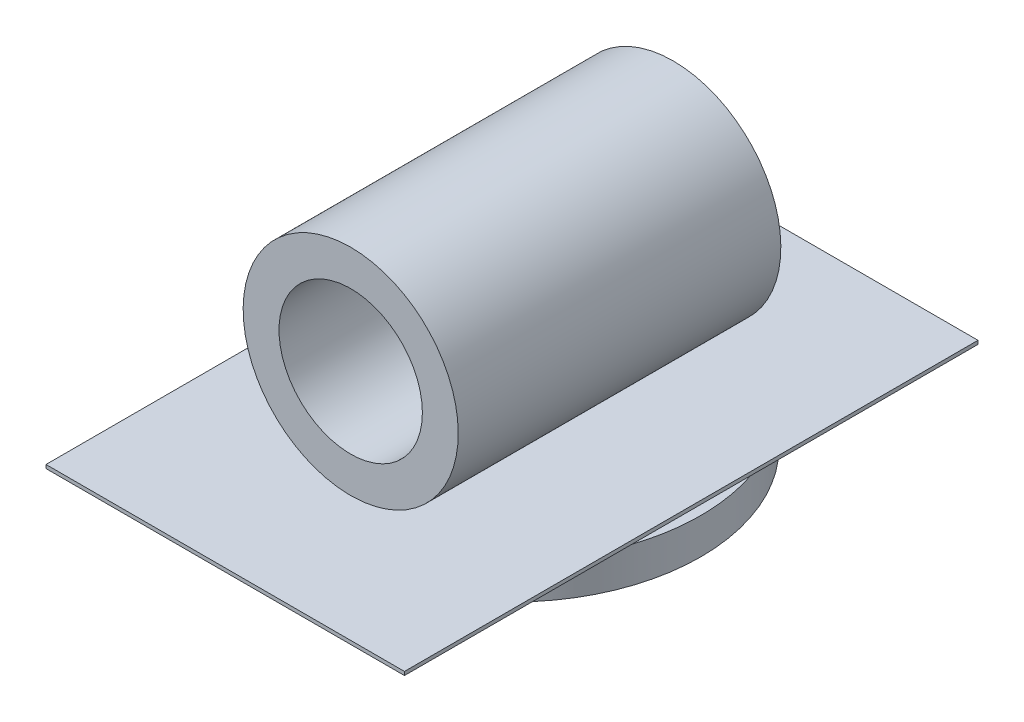
from build123d import *

# Parameters (mm, degrees)
SKETCH1_W           = 50
SKETCH1_H           = 80
BOSS_EXTRUDE1_DEPTH = 0.5
SKETCH4_R           = 26.335590494
BOSS_EXTRUDE2_DEPTH = 5
SKETCH5_R           = 15
BOSS_EXTRUDE3_DEPTH = 22.5
SKETCH7_R           = 10
CUT_EXTRUDE2_DEPTH  = 75.3623798


with BuildPart() as part:
    # Sketch1 → Boss-Extrude1 (new body)
    with BuildSketch(Plane(origin=(0, 0, 0), x_dir=(1, 0, 0), z_dir=(0, 1, 0))):
        Rectangle(SKETCH1_W, SKETCH1_H)
    extrude(amount=BOSS_EXTRUDE1_DEPTH)

    # Sketch4 → Boss-Extrude2 (add)
    with BuildSketch(Plane.XZ):
        with Locations(Location((0, 0, 0), (0, 0, 161.674514968))):
            Circle(SKETCH4_R)
    extrude(amount=BOSS_EXTRUDE2_DEPTH)

    # Sketch5 → Boss-Extrude3 (add, symmetric)
    with BuildSketch(Plane.XY):
        with Locations((0, 15.495084895)):
            Circle(SKETCH5_R)
    extrude(amount=BOSS_EXTRUDE3_DEPTH, both=True)

    # Sketch7 → Cut-Extrude2 (cut, through all)
    with BuildSketch(Plane.XY.offset(22.5)):
        with Locations((0, 15.498342616)):
            Circle(SKETCH7_R)
    extrude(amount=-CUT_EXTRUDE2_DEPTH, mode=Mode.SUBTRACT)


solid = part.part
